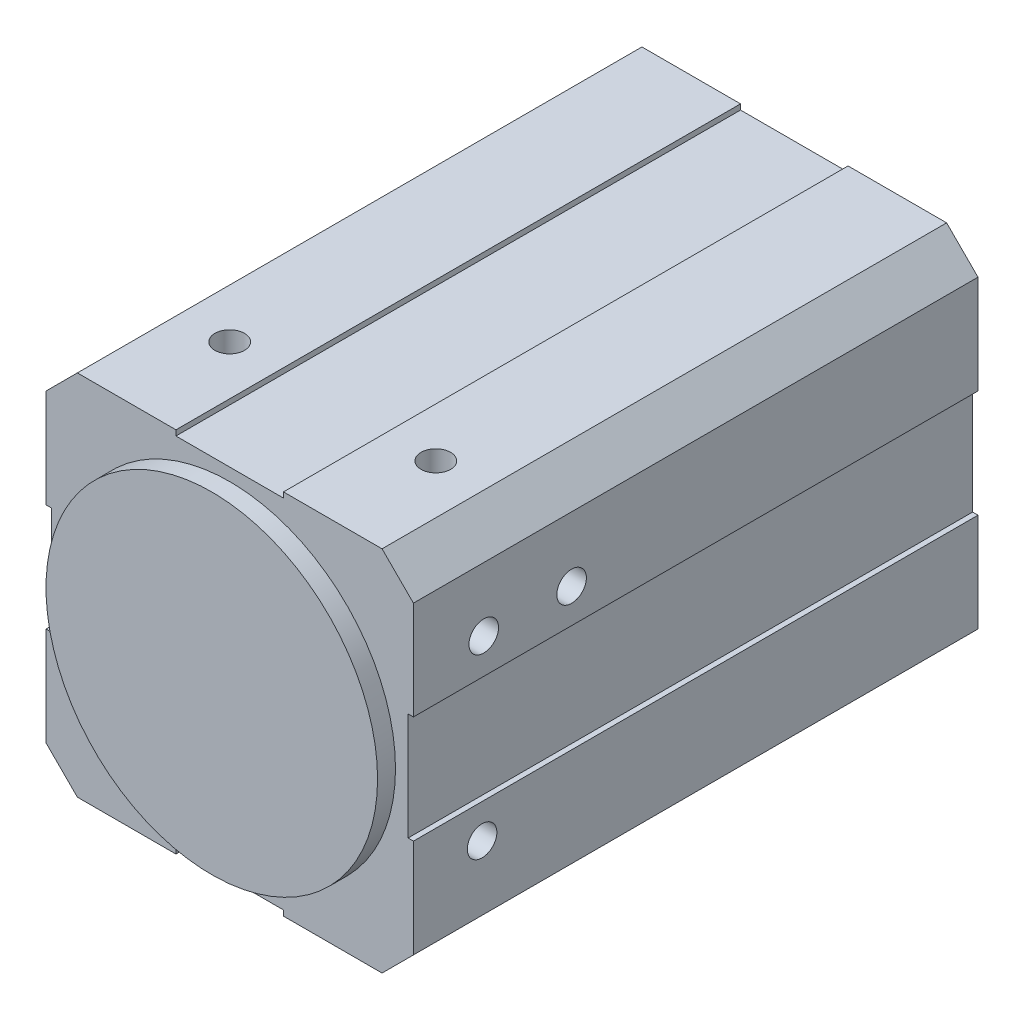
from build123d import *

# Parameters (mm, degrees)
SKETCH_1_W                       = 41
SKETCH_1_H                       = 63
EXTRUDE_1_DEPTH                  = 41
HOLE_WIZARD_M4_1_AT_2_COUNT      = 2
HOLE_WIZARD_M4_1_AT_2_PITCH      = 23
CHAMFER_1_SIZE                   = 3.5
CUT_EXTRUDE_1_REACH              = 79.912
SKETCH_4_W                       = 12
SKETCH_4_H                       = 0.6
SKETCH_4_W_2                     = 0.6
SKETCH_4_H_2                     = 12
SKETCH_5_R                       = 18.5
EXTRUDE_2_DEPTH                  = 2
HOLE_WIZARD_M4_3_D               = 3.3
HOLE_WIZARD_M4_3_DEPTH           = 10.1
HOLE_WIZARD_M4_3_TIP             = 0.991420021
HOLE_WIZARD_M4_3_ON_FACE_2_D     = 3.3
HOLE_WIZARD_M4_3_ON_FACE_2_DEPTH = 10.1
HOLE_WIZARD_M4_3_ON_FACE_2_TIP   = 0.991420021


with BuildPart() as part:
    # 草图1 → 凸台-拉伸1 (new body)
    with BuildSketch(Plane(origin=(0, 0, 0), x_dir=(1, 0, 0), z_dir=(0, 1, 0))):
        Rectangle(SKETCH_1_W, SKETCH_1_H)
    extrude(amount=EXTRUDE_1_DEPTH)

    # 草图3 → M4 螺纹孔1 (revolve, cut)
    with BuildSketch(Plane(origin=(-11.5, 41, 20), x_dir=(0, 0, 1), z_dir=(1, 0, 0))):
        Polygon((0, 0), (0, 6.991420021), (1.65, 6), (1.65, 0), align=None)
    hole_wizard_m4_1 = revolve(axis=Axis((-11.5, 47.35, 20), (0, -1, 0)), mode=Mode.SUBTRACT)

    # M4 螺纹孔1 at 2: M4 螺纹孔1 ×2
    with Locations(*[(i * HOLE_WIZARD_M4_1_AT_2_PITCH, 0, 0) for i in range(1, HOLE_WIZARD_M4_1_AT_2_COUNT)]):
        add(hole_wizard_m4_1, mode=Mode.SUBTRACT)

    # 镜向1: M4 螺纹孔1 across plane
    add(hole_wizard_m4_1.mirror(Plane.ZX.offset(20.5)), mode=Mode.SUBTRACT)

    # 镜向1 copy 1 sketch → 镜向1 copy 1 (revolve, cut)
    with BuildSketch(Plane(origin=(11.5, 0, 20), x_dir=(0, 0, 1), z_dir=(1, 0, 0))):
        Polygon((0, 0), (0, -6.991420021), (1.65, -6), (1.65, 0), align=None)
    revolve(axis=Axis((11.5, -6.35, 20), (0, -1, 0)), mode=Mode.SUBTRACT)

    # 倒角1
    chamfer_1_edges = [part.edges().sort_by_distance(p)[0] for p in [
        (-20.5, 41, 0),
        (20.5, 41, 0),
        (-20.5, 0, 0),
        (20.5, 0, 0),
    ]]
    chamfer(chamfer_1_edges, length=CHAMFER_1_SIZE)

    # 草图4 → 切除-拉伸1 (cut, up to next)
    with BuildSketch(Plane.XY.offset(31.5), mode=Mode.PRIVATE) as cut_extrude_1_sk1:
        with Locations((0, 40.7)):
            Rectangle(SKETCH_4_W, SKETCH_4_H)
    cut_extrude_1_tool1 = extrude(cut_extrude_1_sk1.sketch, amount=-CUT_EXTRUDE_1_REACH, mode=Mode.PRIVATE) & part.part
    # 草图4 → 切除-拉伸1 (cut, up to next)
    with BuildSketch(Plane.XY.offset(31.5), mode=Mode.PRIVATE) as cut_extrude_1_sk2:
        with Locations((20.2, 20.5)):
            Rectangle(SKETCH_4_W_2, SKETCH_4_H_2)
    cut_extrude_1_tool2 = extrude(cut_extrude_1_sk2.sketch, amount=-CUT_EXTRUDE_1_REACH, mode=Mode.PRIVATE) & part.part
    # 草图4 → 切除-拉伸1 (cut, up to next)
    with BuildSketch(Plane.XY.offset(31.5), mode=Mode.PRIVATE) as cut_extrude_1_sk3:
        with Locations((0, 0.3)):
            Rectangle(SKETCH_4_W, SKETCH_4_H)
    cut_extrude_1_tool3 = extrude(cut_extrude_1_sk3.sketch, amount=-CUT_EXTRUDE_1_REACH, mode=Mode.PRIVATE) & part.part
    # 草图4 → 切除-拉伸1 (cut, up to next)
    with BuildSketch(Plane.XY.offset(31.5), mode=Mode.PRIVATE) as cut_extrude_1_sk4:
        with Locations((-20.2, 20.5)):
            Rectangle(SKETCH_4_W_2, SKETCH_4_H_2)
    cut_extrude_1_tool4 = extrude(cut_extrude_1_sk4.sketch, amount=-CUT_EXTRUDE_1_REACH, mode=Mode.PRIVATE) & part.part
    add(cut_extrude_1_tool1.solids().sort_by_distance((0, 40.7, 31.5))[0], mode=Mode.SUBTRACT)
    add(cut_extrude_1_tool2.solids().sort_by_distance((20.2, 20.5, 31.5))[0], mode=Mode.SUBTRACT)
    add(cut_extrude_1_tool3.solids().sort_by_distance((0, 0.3, 31.5))[0], mode=Mode.SUBTRACT)
    add(cut_extrude_1_tool4.solids().sort_by_distance((-20.2, 20.5, 31.5))[0], mode=Mode.SUBTRACT)

    # 草图5 → 凸台-拉伸2 (add)
    with BuildSketch(Plane.XY.offset(31.5)):
        with Locations((0, 20.5)):
            Circle(SKETCH_5_R)
    extrude(amount=EXTRUDE_2_DEPTH)

    # M4 螺纹孔3
    with Locations(Plane(origin=(20.5, 30.405354364, 23.651006077), x_dir=(0, 0, 1), z_dir=(1, 0, 0))):
        with Locations((0, 0), (-9.799993904, 0.098891397), (0.188566307, 19.700944215)):
            Hole(HOLE_WIZARD_M4_3_D / 2, depth=HOLE_WIZARD_M4_3_DEPTH)
            with Locations((0, 0, -(HOLE_WIZARD_M4_3_DEPTH + HOLE_WIZARD_M4_3_TIP / 2))):  # 118° drill point
                Cone(0, HOLE_WIZARD_M4_3_D / 2, HOLE_WIZARD_M4_3_TIP, mode=Mode.SUBTRACT)

    # M4 螺纹孔3 on face 2
    with Locations(Plane(origin=(-20.5, 7.687513873, -0.982360161), x_dir=(0, 0, -1), z_dir=(-1, 0, 0))):
        with Locations((0, 0)):
            Hole(HOLE_WIZARD_M4_3_ON_FACE_2_D / 2, depth=HOLE_WIZARD_M4_3_ON_FACE_2_DEPTH)
            with Locations((0, 0, -(HOLE_WIZARD_M4_3_ON_FACE_2_DEPTH + HOLE_WIZARD_M4_3_ON_FACE_2_TIP / 2))):  # 118° drill point
                Cone(0, HOLE_WIZARD_M4_3_ON_FACE_2_D / 2, HOLE_WIZARD_M4_3_ON_FACE_2_TIP, mode=Mode.SUBTRACT)


solid = part.part
